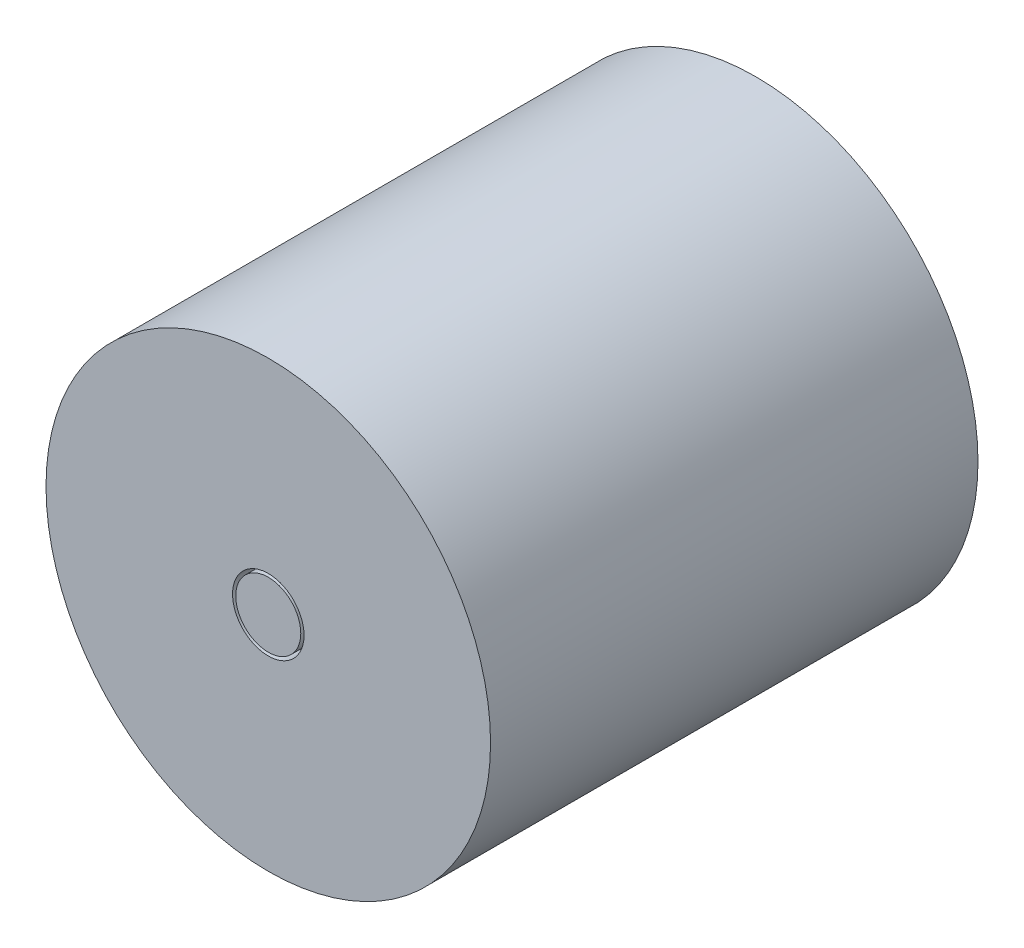
from build123d import *

# Parameters (mm, degrees)
SKETCH_1_R      = 0.01
EXTRUDE_1_DEPTH = 0.15
SKETCH_2_R      = 0.0684
SKETCH_2_R_2    = 0.011
EXTRUDE_5_DEPTH = 0.15


with BuildPart() as part:
    # 草圖1 → 填料-伸長1 (new body)
    with BuildSketch(Plane.XY):
        Circle(SKETCH_1_R)
    extrude(amount=EXTRUDE_1_DEPTH)


with BuildPart() as body_2:
    # 草圖2 → 填料-伸長5 (new body)
    with BuildSketch(Plane.XY.offset(0.15)):
        Circle(SKETCH_2_R)
        Circle(SKETCH_2_R_2, mode=Mode.SUBTRACT)
    extrude(amount=-EXTRUDE_5_DEPTH)


solid = Compound([part.part, body_2.part])
